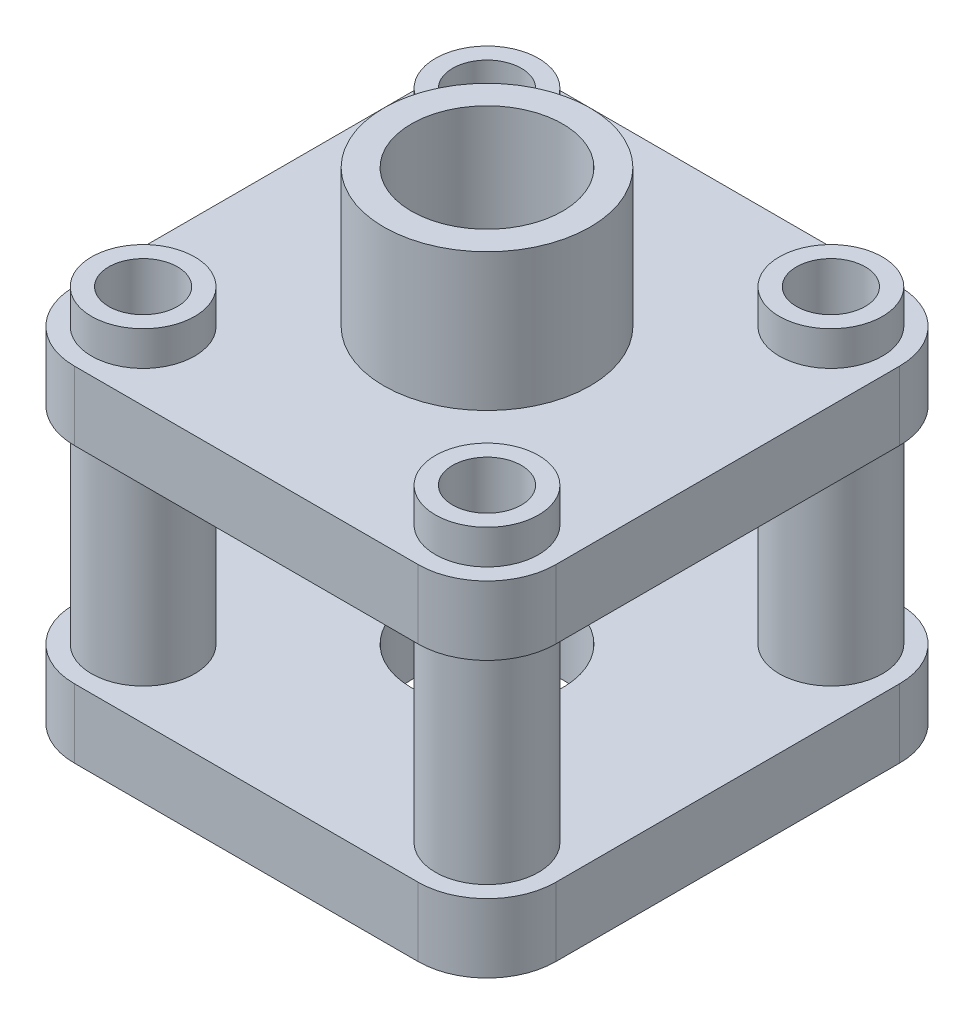
from build123d import *

# Parameters (mm, degrees)
SKETCH1_R           = 5
SKETCH1_R_2         = 11
BOSS_EXTRUDE1_DEPTH = 10
SKETCH1_5_R         = 7.5
SKETCH1_5_R_2       = 5
BOSS_EXTRUDE2_DEPTH = 40
SKETCH2_R           = 7.5
SKETCH2_R_2         = 15
BOSS_EXTRUDE5_DEPTH = 10
SKETCH2_6_R         = 7.5
SKETCH2_6_R_2       = 5
BOSS_EXTRUDE6_DEPTH = 15
SKETCH2_7_R         = 15
SKETCH2_7_R_2       = 11
BOSS_EXTRUDE7_DEPTH = 30


with BuildPart() as part:
    # Sketch1 → Boss-Extrude1 (new body)
    with BuildSketch(Plane(origin=(0, 0, 0), x_dir=(1, 0, 0), z_dir=(0, 1, 0))):
        with BuildLine():
            Line((25, 35), (-25, 35))
            ThreePointArc((-25, 35), (-32.071067812, 32.071067812), (-35, 25))
            Line((-35, 25), (-35, -25))
            ThreePointArc((-35, -25), (-32.071067812, -32.071067812), (-25, -35))
            Line((-25, -35), (25, -35))
            ThreePointArc((25, -35), (32.071067812, -32.071067812), (35, -25))
            Line((35, -25), (35, 25))
            ThreePointArc((35, 25), (32.071067812, 32.071067812), (25, 35))
        make_face()
        with Locations((-25, -25)):
            Circle(SKETCH1_R, mode=Mode.SUBTRACT)
        with Locations((25, -25)):
            Circle(SKETCH1_R, mode=Mode.SUBTRACT)
        with Locations((-25, 25)):
            Circle(SKETCH1_R, mode=Mode.SUBTRACT)
        Circle(SKETCH1_R_2, mode=Mode.SUBTRACT)
        with Locations((25, 25)):
            Circle(SKETCH1_R, mode=Mode.SUBTRACT)
    extrude(amount=BOSS_EXTRUDE1_DEPTH)

    # Sketch1<5> → Boss-Extrude2 (add)
    # profile 1 of 4: a face of its own
    with BuildSketch(Plane(origin=(0, 0, 0), x_dir=(1, 0, 0), z_dir=(0, 1, 0))):
        with Locations((-25, 25)):
            Circle(SKETCH1_5_R)
        with Locations((-25, 25)):
            Circle(SKETCH1_5_R_2, mode=Mode.SUBTRACT)
    # profile 2 of 4: a face of its own
    with BuildSketch(Plane(origin=(0, 0, 0), x_dir=(1, 0, 0), z_dir=(0, 1, 0))):
        with Locations((25, 25)):
            Circle(SKETCH1_5_R)
        with Locations((25, 25)):
            Circle(SKETCH1_5_R_2, mode=Mode.SUBTRACT)
    # profile 3 of 4: a face of its own
    with BuildSketch(Plane(origin=(0, 0, 0), x_dir=(1, 0, 0), z_dir=(0, 1, 0))):
        with Locations((25, -25)):
            Circle(SKETCH1_5_R)
        with Locations((25, -25)):
            Circle(SKETCH1_5_R_2, mode=Mode.SUBTRACT)
    # profile 4 of 4: a face of its own
    with BuildSketch(Plane(origin=(0, 0, 0), x_dir=(1, 0, 0), z_dir=(0, 1, 0))):
        with Locations((-25, -25)):
            Circle(SKETCH1_5_R)
        with Locations((-25, -25)):
            Circle(SKETCH1_5_R_2, mode=Mode.SUBTRACT)
    extrude(amount=BOSS_EXTRUDE2_DEPTH)



with BuildPart() as body_2:
    # Sketch2 → Boss-Extrude5 (new body)
    with BuildSketch(Plane(origin=(0, 40, 0), x_dir=(1, 0, 0), z_dir=(0, 1, 0))):
        with BuildLine():
            ThreePointArc((35, 25), (32.071067812, 32.071067812), (25, 35))
            Line((25, 35), (-25, 35))
            ThreePointArc((-25, 35), (-32.071067812, 32.071067812), (-35, 25))
            Line((-35, 25), (-35, -25))
            ThreePointArc((-35, -25), (-32.071067812, -32.071067812), (-25, -35))
            Line((-25, -35), (25, -35))
            ThreePointArc((25, -35), (32.071067812, -32.071067812), (35, -25))
            Line((35, -25), (35, 25))
        make_face()
        with Locations((-25, -25)):
            Circle(SKETCH2_R, mode=Mode.SUBTRACT)
        with Locations((25, -25)):
            Circle(SKETCH2_R, mode=Mode.SUBTRACT)
        with Locations((-25, 25)):
            Circle(SKETCH2_R, mode=Mode.SUBTRACT)
        Circle(SKETCH2_R_2, mode=Mode.SUBTRACT)
        with Locations((25, 25)):
            Circle(SKETCH2_R, mode=Mode.SUBTRACT)
    extrude(amount=BOSS_EXTRUDE5_DEPTH)


with BuildPart() as part_1:
    add(part.part)

    add(body_2.part)  # Boss-Extrude6 merges body 2
    # Sketch2<6> → Boss-Extrude6 (add)
    # profile 1 of 4: a face of its own
    with BuildSketch(Plane(origin=(0, 40, 0), x_dir=(1, 0, 0), z_dir=(0, 1, 0))):
        with Locations((25, 25)):
            Circle(SKETCH2_6_R)
        with Locations((25, 25)):
            Circle(SKETCH2_6_R_2, mode=Mode.SUBTRACT)
    # profile 2 of 4: a face of its own
    with BuildSketch(Plane(origin=(0, 40, 0), x_dir=(1, 0, 0), z_dir=(0, 1, 0))):
        with Locations((25, -25)):
            Circle(SKETCH2_6_R)
        with Locations((25, -25)):
            Circle(SKETCH2_6_R_2, mode=Mode.SUBTRACT)
    # profile 3 of 4: a face of its own
    with BuildSketch(Plane(origin=(0, 40, 0), x_dir=(1, 0, 0), z_dir=(0, 1, 0))):
        with Locations((-25, -25)):
            Circle(SKETCH2_6_R)
        with Locations((-25, -25)):
            Circle(SKETCH2_6_R_2, mode=Mode.SUBTRACT)
    # profile 4 of 4: a face of its own
    with BuildSketch(Plane(origin=(0, 40, 0), x_dir=(1, 0, 0), z_dir=(0, 1, 0))):
        with Locations((-25, 25)):
            Circle(SKETCH2_6_R)
        with Locations((-25, 25)):
            Circle(SKETCH2_6_R_2, mode=Mode.SUBTRACT)
    extrude(amount=BOSS_EXTRUDE6_DEPTH)

    # Sketch2<7> → Boss-Extrude7 (add)
    with BuildSketch(Plane(origin=(0, 40, 0), x_dir=(1, 0, 0), z_dir=(0, 1, 0))):
        Circle(SKETCH2_7_R)
        Circle(SKETCH2_7_R_2, mode=Mode.SUBTRACT)
    extrude(amount=BOSS_EXTRUDE7_DEPTH)


solid = part_1.part
